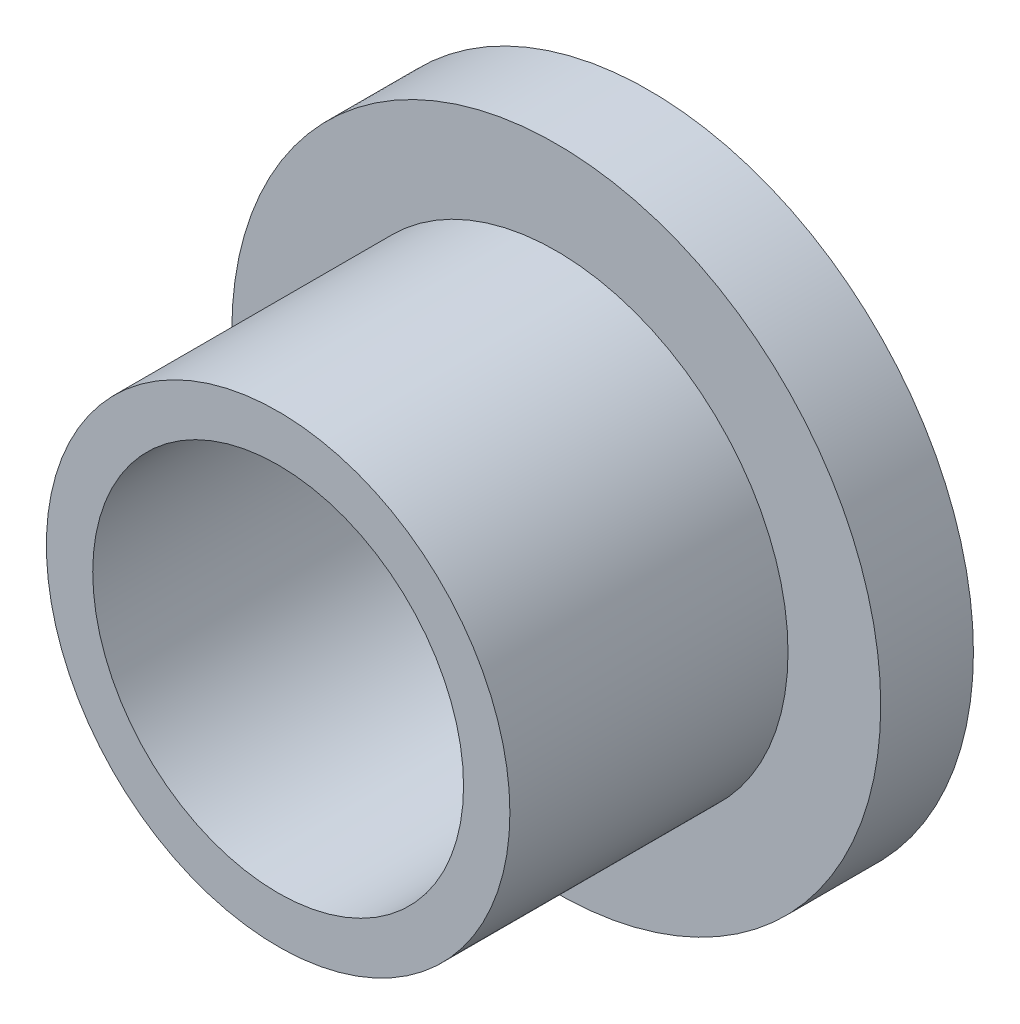
from build123d import *


with BuildPart() as part:
    # Sketch1 → Revolve1 (revolve)
    with BuildSketch(Plane(origin=(0, 0, 0), x_dir=(0, 0, -1), z_dir=(1, 0, 0)), mode=Mode.PRIVATE) as revolve1_sk:
        Polygon((0, 6.35), (0, 7.9375), (9.525, 7.9375), (9.525, 11.1125), (12.7, 11.1125), (12.7, 6.35), align=None)
    revolve(revolve1_sk.sketch.rotate(Axis((0, 0, 43.380484165), (0, 0, -1)), 90), axis=Axis((0, 0, 43.380484165), (0, 0, -1)))


solid = part.part
